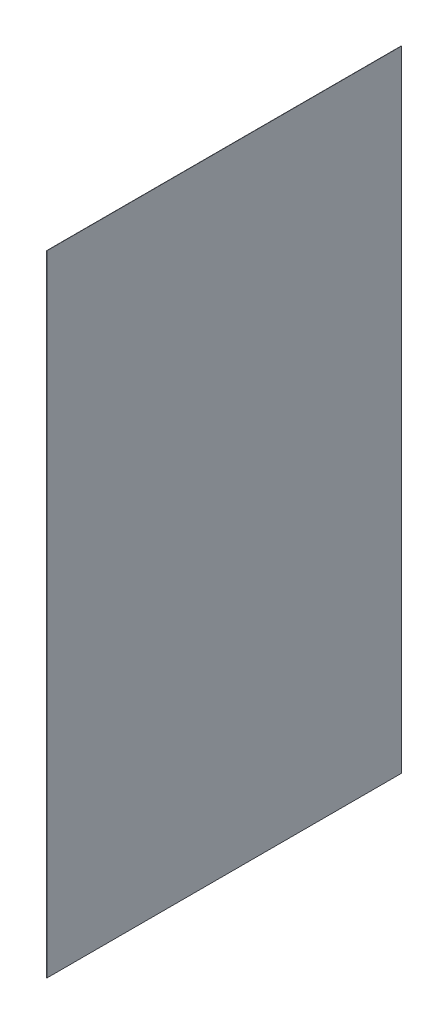
from build123d import *

# Parameters (mm, degrees)
BOSS_EXTRUDE1_DEPTH = 1


with BuildPart() as part:
    # 3DSketch1 → Boss-Extrude1 (new body)
    with BuildSketch(Plane(origin=(3152.268644974, 1435.215454545, 807.442909091), x_dir=(0, -0.8715407086393898, -0.49032315179313146), z_dir=(1, 0, 0))):
        Polygon((0, 0), (2501.697388609, -1407.43873035), (3293.513292766, 0), (791.815904157, 1407.43873035), align=None)
    extrude(amount=BOSS_EXTRUDE1_DEPTH)


solid = part.part
